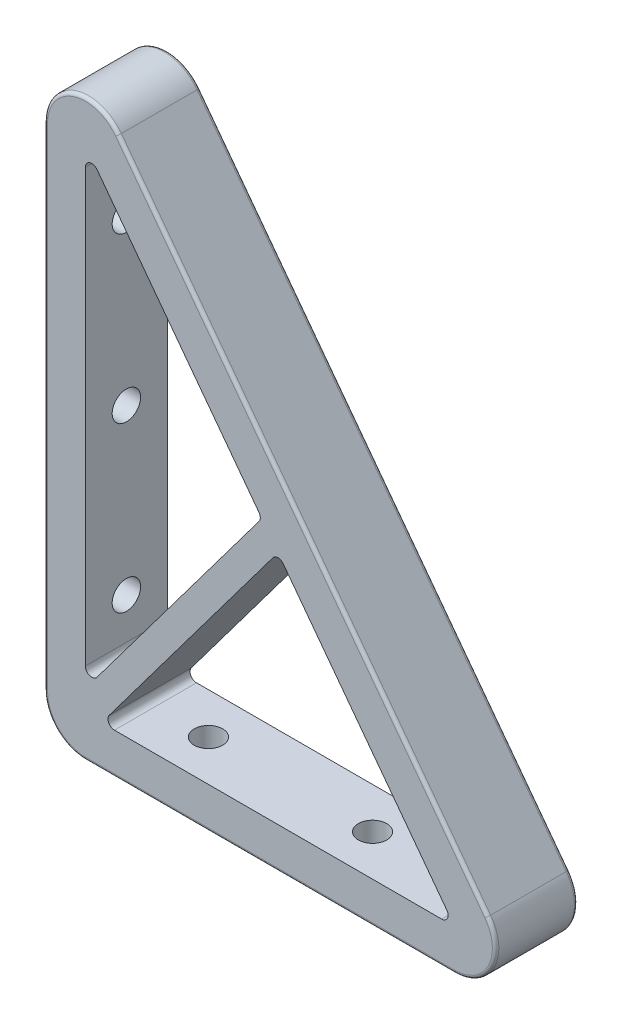
from build123d import *

# Parameters (mm, degrees)
BOSS_EXTRUDE1_DEPTH = 12.7
FILLET1_R           = 6.35
FILLET2_R           = 1
CUT_EXTRUDE1_REACH  = 115.77
SKETCH2_R           = 2.2
CUT_EXTRUDE2_REACH  = 125.947
SKETCH3_R           = 2.2
FILLET3_R           = 0.5


with BuildPart() as part:
    # Sketch1 → Boss-Extrude1 (new body)
    # profile 1 of 3: a face of its own
    with BuildSketch(Plane.XY):
        Polygon((0, 0), (0, -101.6), (76.2, -101.6), align=None)
        Polygon((63.5, -95.25), (6.35, -19.05), (6.35, -95.25), align=None, mode=Mode.SUBTRACT)
    # profile 2 of 3: a face of its own
    with BuildSketch(Plane.XY):
        Polygon((34.925, -57.15), (6.35, -95.25), (8.85, -95.25), (36.175, -58.816666667), align=None)
    # profile 3 of 3: a face of its own
    with BuildSketch(Plane.XY):
        Polygon((33.675, -55.483333333), (6.35, -91.916666667), (6.35, -95.25), (34.925, -57.15), align=None)
    extrude(amount=BOSS_EXTRUDE1_DEPTH)

    # Fillet1
    fillet1_edges = [part.edges().sort_by_distance(p)[0] for p in [
        (0, 0, 6.35),
        (76.2, -101.6, 6.35),
        (0, -101.6, 6.35),
    ]]
    fillet(fillet1_edges, radius=FILLET1_R)

    # Fillet2
    fillet2_edges = [part.edges().sort_by_distance(p)[0] for p in [
        (36.175, -58.816666667, 6.35),
        (8.85, -95.25, 6.35),
        (63.5, -95.25, 6.35),
        (6.35, -19.05, 6.35),
        (6.35, -91.916666667, 6.35),
        (33.675, -55.483333333, 6.35),
    ]]
    fillet(fillet2_edges, radius=FILLET2_R)

    # Sketch2 → Cut-Extrude1 (cut, up to next)
    with BuildSketch(Plane.XZ.offset(101.6), mode=Mode.PRIVATE) as cut_extrude1_sk1:
        with Locations(Location((19.05, 6.35, 0), (0, 0, 270))):
            Circle(SKETCH2_R)
    cut_extrude1_tool1 = extrude(cut_extrude1_sk1.sketch, amount=-CUT_EXTRUDE1_REACH, mode=Mode.PRIVATE) & part.part
    # Sketch2 → Cut-Extrude1 (cut, up to next)
    with BuildSketch(Plane.XZ.offset(101.6), mode=Mode.PRIVATE) as cut_extrude1_sk2:
        with Locations(Location((44.45, 6.35, 0), (0, 0, 270))):
            Circle(SKETCH2_R)
    cut_extrude1_tool2 = extrude(cut_extrude1_sk2.sketch, amount=-CUT_EXTRUDE1_REACH, mode=Mode.PRIVATE) & part.part
    add(cut_extrude1_tool1.solids().sort_by_distance((19.05, -101.6, 6.35))[0], mode=Mode.SUBTRACT)
    add(cut_extrude1_tool2.solids().sort_by_distance((44.45, -101.6, 6.35))[0], mode=Mode.SUBTRACT)

    # Sketch3 → Cut-Extrude2 (cut, up to next)
    with BuildSketch(Plane.ZY, mode=Mode.PRIVATE) as cut_extrude2_sk1:
        with Locations(Location((6.35, -82.55, 0), (0, 0, 270))):
            Circle(SKETCH3_R)
    cut_extrude2_tool1 = extrude(cut_extrude2_sk1.sketch, amount=-CUT_EXTRUDE2_REACH, mode=Mode.PRIVATE) & part.part
    # Sketch3 → Cut-Extrude2 (cut, up to next)
    with BuildSketch(Plane.ZY, mode=Mode.PRIVATE) as cut_extrude2_sk2:
        with Locations(Location((6.35, -57.15, 0), (0, 0, 270))):
            Circle(SKETCH3_R)
    cut_extrude2_tool2 = extrude(cut_extrude2_sk2.sketch, amount=-CUT_EXTRUDE2_REACH, mode=Mode.PRIVATE) & part.part
    # Sketch3 → Cut-Extrude2 (cut, up to next)
    with BuildSketch(Plane.ZY, mode=Mode.PRIVATE) as cut_extrude2_sk3:
        with Locations(Location((6.35, -31.75, 0), (0, 0, 270))):
            Circle(SKETCH3_R)
    cut_extrude2_tool3 = extrude(cut_extrude2_sk3.sketch, amount=-CUT_EXTRUDE2_REACH, mode=Mode.PRIVATE) & part.part
    add(cut_extrude2_tool1.solids().sort_by_distance((0, -82.55, 6.35))[0], mode=Mode.SUBTRACT)
    add(cut_extrude2_tool2.solids().sort_by_distance((0, -57.15, 6.35))[0], mode=Mode.SUBTRACT)
    add(cut_extrude2_tool3.solids().sort_by_distance((0, -31.75, 6.35))[0], mode=Mode.SUBTRACT)

    # Fillet3
    fillet3_edges = [part.edges().sort_by_distance(p)[0] for p in [
        (34.925, -101.6, 0),
        (34.925, -101.6, 12.7),
        (0, -57.15, 0),
        (40.005, -53.34, 0),
        (69.179612663, -98.089806331, 0),
        (4.341953686, -13.025861057, 0),
        (1.859871939, -99.740128061, 0),
        (0, -57.15, 12.7),
        (40.005, -53.34, 12.7),
        (69.179612663, -98.089806331, 12.7),
        (4.341953686, -13.025861057, 12.7),
        (1.859871939, -99.740128061, 12.7),
    ]]
    fillet(fillet3_edges, radius=FILLET3_R)


solid = part.part
